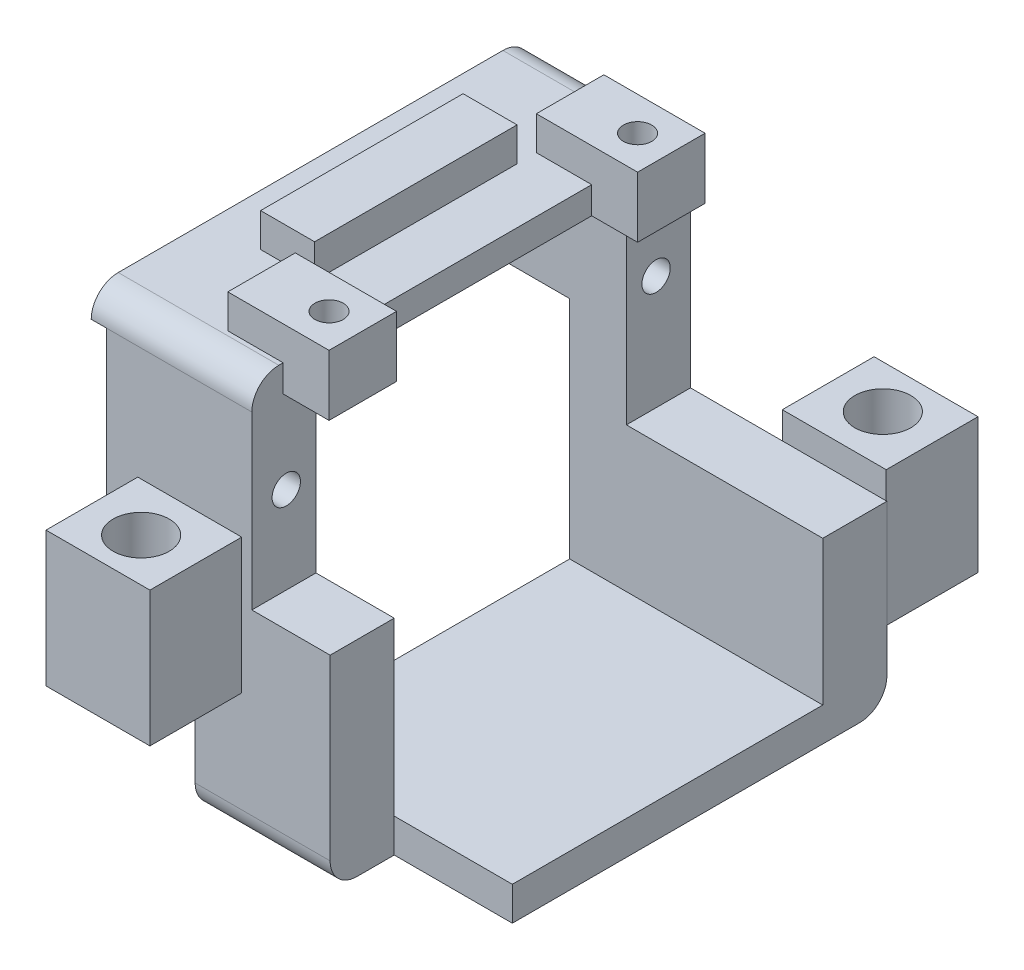
from build123d import *

# Parameters (mm, degrees)
BOSS_EXTRUDE1_DEPTH      = 2.5
BOSS_EXTRUDE2_DEPTH      = 12.7
BOSS_EXTRUDE3_START      = 12.7
SKETCH3_W                = 11.9
SKETCH3_H                = 4.75
SKETCH3_W_2              = 10.75
BOSS_EXTRUDE3_DEPTH      = 12.7
BOSS_EXTRUDE4_START      = 25.4
SKETCH3_3_W              = 11.9
SKETCH3_3_H              = 4.75
SKETCH3_3_W_2            = 10.75
SKETCH3_3_W_3            = 1.15
BOSS_EXTRUDE4_DEPTH      = 2
CUT_EXTRUDE1_START       = -1.1
SKETCH2_R                = 1.05
CUT_EXTRUDE1_DEPTH       = 8
CUT_EXTRUDE2_START       = 3.1
SKETCH2_3_R              = 1.05
CUT_EXTRUDE2_DEPTH       = 8
BOSS_EXTRUDE5_START      = 7
SKETCH1_4_R              = 2.075
BOSS_EXTRUDE5_DEPTH      = 10
BOSS_EXTRUDE6_START      = 12.7
SKETCH1_7_W              = 7.7
SKETCH1_7_H              = 6.8
SKETCH1_7_R              = 2.075
BOSS_EXTRUDE6_DEPTH      = 10
FILLET1_R                = 2
CUT_EXTRUDE3_START       = 12.7
SKETCH5_W                = 14.55
SKETCH5_H                = 4.75
CUT_EXTRUDE3_DEPTH       = 2
CUT_EXTRUDE4_START       = 12.7
SKETCH6_W                = 7.7
SKETCH6_H                = 4.75
CUT_EXTRUDE4_DEPTH       = 4
BOSS_EXTRUDE7_DEPTH      = 2.5
BOSS_EXTRUDE7_DEPTH_BACK = 2
BOSS_EXTRUDE7_START      = 27.4
SKETCH7_W                = 4
SKETCH7_H                = 15
SKETCH7_W_2              = 5
SKETCH7_H_2              = 5
SKETCH7_R                = 1.05
SKETCH7_W_3              = 2.5


with BuildPart() as part:
    # Sketch1 → Boss-Extrude1 (new body)
    with BuildSketch(Plane(origin=(0, 0, 0), x_dir=(1, 0, 0), z_dir=(0, 1, 0))):
        Polygon((-1.1, 16.25), (-1.1, -16.25), (8.9, -16.25), (8.9, -11.5), (17.65, -11.5), (17.65, 16.25), align=None)
    extrude(amount=-BOSS_EXTRUDE1_DEPTH)

    # Sketch1<3> → Boss-Extrude2 (add)
    with BuildSketch(Plane(origin=(0, 0, 0), x_dir=(1, 0, 0), z_dir=(0, 1, 0))):
        Polygon((9.9, 16.25), (-1.1, 16.25), (-1.1, 11.5), (17.65, 11.5), (17.65, 16.25), (17.6, 16.25), align=None)
        Polygon((8.9, -11.5), (-1.1, -11.5), (-1.1, -16.25), (2.35, -16.25), (8.9, -16.25), align=None)
    extrude(amount=BOSS_EXTRUDE2_DEPTH)

    # Sketch3 → Boss-Extrude3 (add)
    with BuildSketch(Plane(origin=(0, 0, 0), x_dir=(1, 0, 0), z_dir=(0, 1, 0)).offset(BOSS_EXTRUDE3_START)):
        with Locations((-2.85, 13.875)):
            Rectangle(SKETCH3_W, SKETCH3_H)
        with Locations((-2.275, -13.875)):
            Rectangle(SKETCH3_W_2, SKETCH3_H)
    extrude(amount=BOSS_EXTRUDE3_DEPTH)

    # Sketch3<3> → Boss-Extrude4 (add)
    with BuildSketch(Plane(origin=(0, 0, 0), x_dir=(1, 0, 0), z_dir=(0, 1, 0)).offset(BOSS_EXTRUDE4_START)):
        with Locations((-2.85, 13.875)):
            Rectangle(SKETCH3_3_W, SKETCH3_3_H)
        Polygon((3.1, -11.5), (3.1, 11.5), (-8.8, 11.5), (-8.8, -11.5), (-7.65, -11.5), align=None)
        with Locations((-2.275, -13.875)):
            Rectangle(SKETCH3_3_W_2, SKETCH3_3_H)
        with Locations((-8.225, -13.875)):
            Rectangle(SKETCH3_3_W_3, SKETCH3_3_H)
    extrude(amount=BOSS_EXTRUDE4_DEPTH)

    # Sketch2 → Cut-Extrude1 (cut)
    with BuildSketch(Plane(origin=(0, 0, 0), x_dir=(0, 0, -1), z_dir=(1, 0, 0)).offset(CUT_EXTRUDE1_START)):
        with Locations(Location((-13.7, 6.45, 0), (0, 0, 180))):
            Circle(SKETCH2_R)
        with Locations(Location((13.7, 6.45, 0), (0, 0, 180))):
            Circle(SKETCH2_R)
    extrude(amount=CUT_EXTRUDE1_DEPTH, mode=Mode.SUBTRACT)

    # Sketch2<3> → Cut-Extrude2 (cut)
    with BuildSketch(Plane(origin=(0, 0, 0), x_dir=(0, 0, -1), z_dir=(1, 0, 0)).offset(CUT_EXTRUDE2_START)):
        with Locations(Location((13.7, 19.15, 0), (0, 0, 180))):
            Circle(SKETCH2_3_R)
        with Locations(Location((-13.7, 19.15, 0), (0, 0, 180))):
            Circle(SKETCH2_3_R)
    extrude(amount=-CUT_EXTRUDE2_DEPTH, mode=Mode.SUBTRACT)

    # Sketch1<4> → Boss-Extrude5 (add)
    with BuildSketch(Plane(origin=(0, 0, 0), x_dir=(1, 0, 0), z_dir=(0, 1, 0)).offset(BOSS_EXTRUDE5_START)):
        Polygon((2.35, -16.25), (-1.1, -16.25), (-3.8, -16.25), (-5.35, -16.25), (-5.35, -23.05), (2.35, -23.05), align=None)
        with Locations(Location((-1.5, -19.85, 0), (0, 0, 270))):
            Circle(SKETCH1_4_R, mode=Mode.SUBTRACT)
    extrude(amount=BOSS_EXTRUDE5_DEPTH)

    # Sketch1<7> → Boss-Extrude6 (add)
    with BuildSketch(Plane(origin=(0, 0, 0), x_dir=(1, 0, 0), z_dir=(0, 1, 0)).offset(BOSS_EXTRUDE6_START)):
        with Locations((13.75, 19.65)):
            Rectangle(SKETCH1_7_W, SKETCH1_7_H)
        with Locations(Location((13.75, 19.85, 0), (0, 0, 270))):
            Circle(SKETCH1_7_R, mode=Mode.SUBTRACT)
    extrude(amount=-BOSS_EXTRUDE6_DEPTH)

    # Fillet1
    fillet1_edges = [part.edges().sort_by_distance(p)[0] for p in [
        (3.9, -2.5, 16.25),
        (-2.85, 27.4, 16.25),
        (8.275, -2.5, -16.25),
        (-2.85, 27.4, -16.25),
    ]]
    fillet(fillet1_edges, radius=FILLET1_R)

    # Sketch5 → Cut-Extrude3 (cut)
    with BuildSketch(Plane(origin=(0, 0, 0), x_dir=(1, 0, 0), z_dir=(0, 1, 0)).offset(CUT_EXTRUDE3_START)):
        with Locations((10.375, 13.875)):
            Rectangle(SKETCH5_W, SKETCH5_H)
    extrude(amount=-CUT_EXTRUDE3_DEPTH, mode=Mode.SUBTRACT)

    # Sketch6 → Cut-Extrude4 (cut)
    with BuildSketch(Plane(origin=(0, 0, 0), x_dir=(1, 0, 0), z_dir=(0, 1, 0)).offset(CUT_EXTRUDE4_START)):
        with Locations((-4.95, 13.875)):
            Rectangle(SKETCH6_W, SKETCH6_H)
    extrude(amount=CUT_EXTRUDE4_DEPTH, mode=Mode.SUBTRACT)

    # Sketch7 → Boss-Extrude7 (add, two sides: drawn at the far end of the back side and taken through both)
    # profile 1 of 5: a face of its own
    with BuildSketch(Plane(origin=(0, 0, 0), x_dir=(1, 0, 0), z_dir=(0, 1, 0)).offset(BOSS_EXTRUDE7_START - BOSS_EXTRUDE7_DEPTH_BACK)):
        with Locations((-3, 0)):
            Rectangle(SKETCH7_W, SKETCH7_H)
    # profile 2 of 5: a face of its own
    with BuildSketch(Plane(origin=(0, 0, 0), x_dir=(1, 0, 0), z_dir=(0, 1, 0)).offset(BOSS_EXTRUDE7_START - BOSS_EXTRUDE7_DEPTH_BACK)):
        with Locations((4, -11.43)):
            Rectangle(SKETCH7_W_2, SKETCH7_H_2)
        with Locations(Location((4, -11.43, 0), (0, 0, 211.002719134))):
            Circle(SKETCH7_R, mode=Mode.SUBTRACT)
    # profile 3 of 5: a face of its own
    with BuildSketch(Plane(origin=(0, 0, 0), x_dir=(1, 0, 0), z_dir=(0, 1, 0)).offset(BOSS_EXTRUDE7_START - BOSS_EXTRUDE7_DEPTH_BACK)):
        with Locations((0.25, -11.43)):
            Rectangle(SKETCH7_W_3, SKETCH7_H_2)
    # profile 4 of 5: a face of its own
    with BuildSketch(Plane(origin=(0, 0, 0), x_dir=(1, 0, 0), z_dir=(0, 1, 0)).offset(BOSS_EXTRUDE7_START - BOSS_EXTRUDE7_DEPTH_BACK)):
        with Locations((0.25, 11.43)):
            Rectangle(SKETCH7_W_3, SKETCH7_H_2)
    # profile 5 of 5: a face of its own
    with BuildSketch(Plane(origin=(0, 0, 0), x_dir=(1, 0, 0), z_dir=(0, 1, 0)).offset(BOSS_EXTRUDE7_START - BOSS_EXTRUDE7_DEPTH_BACK)):
        with Locations((4, 11.43)):
            Rectangle(SKETCH7_W_2, SKETCH7_H_2)
        with Locations(Location((4, 11.43, 0), (0, 0, 211.002719134))):
            Circle(SKETCH7_R, mode=Mode.SUBTRACT)
    extrude(amount=BOSS_EXTRUDE7_DEPTH + BOSS_EXTRUDE7_DEPTH_BACK)


solid = part.part
